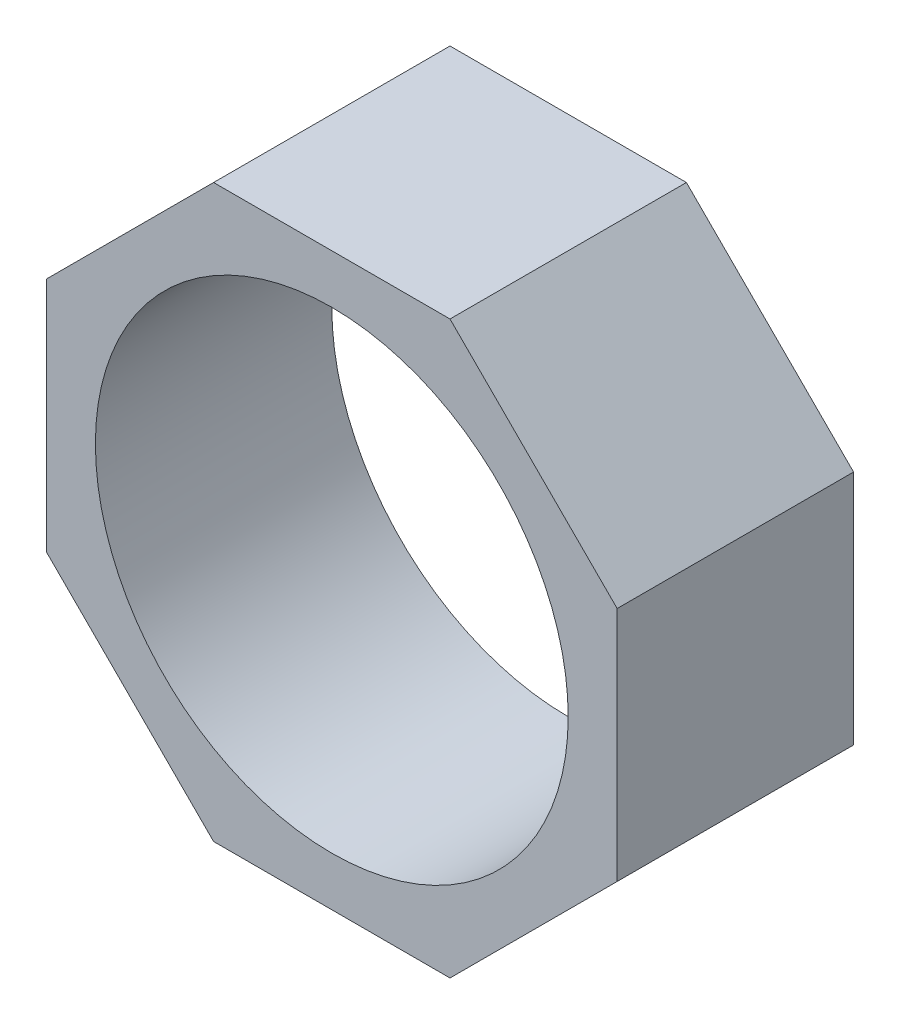
from build123d import *

# Parameters (mm, degrees)
SKETCH1_R           = 2.5
BOSS_EXTRUDE1_DEPTH = 2.5


with BuildPart() as part:
    # Sketch1 → Boss-Extrude1 (new body)
    with BuildSketch(Plane.XY):
        Polygon((-1.25, 3.017766953), (1.25, 3.017766953), (3.017766953, 1.25), (3.017766953, -1.25), (1.25, -3.017766953), (-1.25, -3.017766953), (-3.017766953, -1.25), (-3.017766953, 1.25), align=None)
        Circle(SKETCH1_R, mode=Mode.SUBTRACT)
    extrude(amount=BOSS_EXTRUDE1_DEPTH)


solid = part.part
